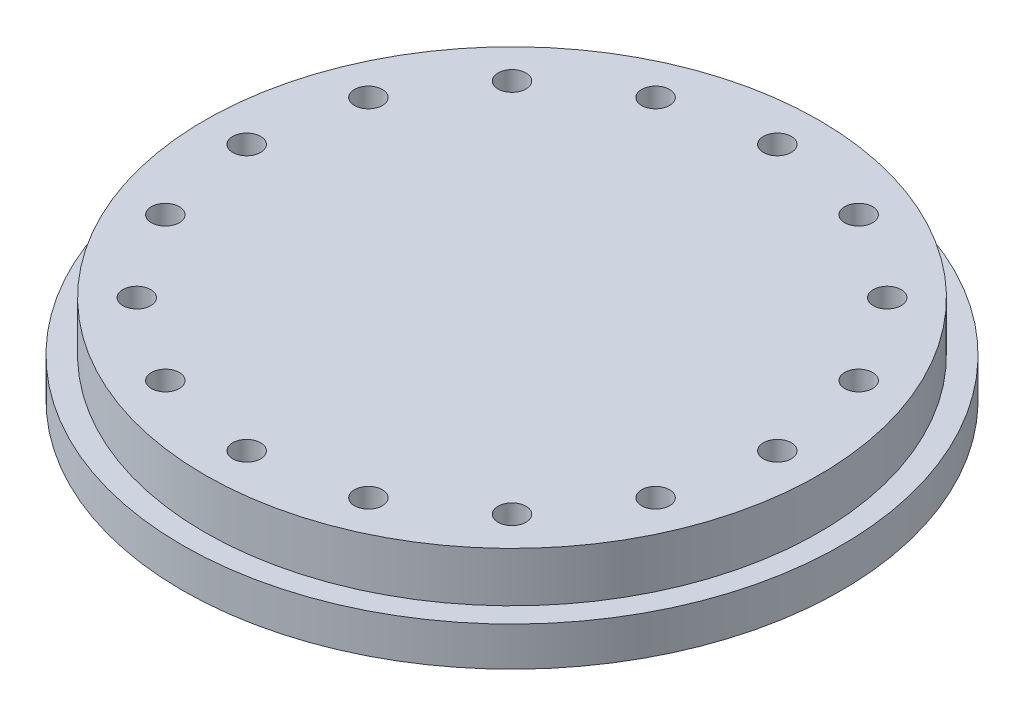
from build123d import *

# Parameters (mm, degrees)
SKETCH1_R           = 29.5
BOSS_EXTRUDE1_DEPTH = 1.75
SKETCH2_R           = 27.5
BOSS_EXTRUDE2_DEPTH = 4.45
SKETCH3_R           = 1.25
CUT_EXTRUDE1_DEPTH  = 43.470018837
CIRPATTERN1_COUNT   = 16


with BuildPart() as part:
    # Sketch1 → Boss-Extrude1 (new, symmetric)
    with BuildSketch(Plane(origin=(0, 0, 0), x_dir=(1, 0, 0), z_dir=(0, 1, 0))):
        with Locations(Location((0, 0, 0), (0, 0, 270))):
            Circle(SKETCH1_R)
    extrude(amount=BOSS_EXTRUDE1_DEPTH, both=True)

    # Sketch2 → Boss-Extrude2 (add)
    with BuildSketch(Plane(origin=(0, 1.75, 0), x_dir=(1, 0, 0), z_dir=(0, 1, 0))):
        with Locations(Location((0, 0, 0), (0, 0, 270))):
            Circle(SKETCH2_R)
    extrude(amount=BOSS_EXTRUDE2_DEPTH)

    # Sketch3 → Cut-Extrude1 (cut, through all)
    with BuildSketch(Plane.XZ.offset(1.75)):
        with Locations(Location((0, 23.75, 0), (0, 0, 270))):
            Circle(SKETCH3_R)
    cut_extrude1 = extrude(amount=-CUT_EXTRUDE1_DEPTH, mode=Mode.SUBTRACT)

    # CirPattern1: Cut-Extrude1 ×16 about axis
    cirpattern1_axis = Axis((0, 0, 0), (0, 1, 0))
    for i in range(1, CIRPATTERN1_COUNT):
        add(cut_extrude1.rotate(cirpattern1_axis, i * 360 / CIRPATTERN1_COUNT), mode=Mode.SUBTRACT)


solid = part.part
